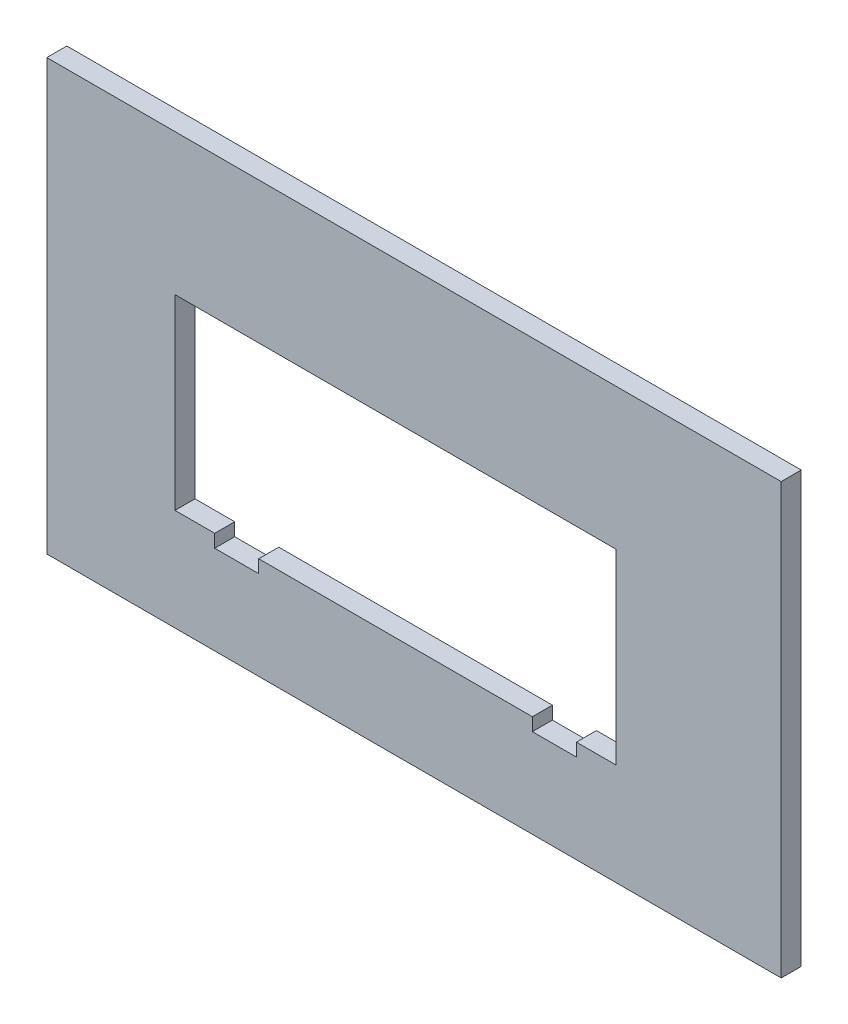
from build123d import *

# Parameters (mm, degrees)
SKETCH3_W               = 55.024039141
SKETCH3_H               = 32.210333873
BOSS_EXTRUDE1_DEPTH     = 1.5
SKETCH4_W               = 14
SKETCH4_H               = 14
CUT_EXTRUDE1_DEPTH      = 1.5
CUT_EXTRUDE4_DEPTH      = 327.051192929
CUT_EXTRUDE4_DEPTH_BACK = 327.051192929


with BuildPart() as part:
    # Sketch3 → Boss-Extrude1 (new body)
    with BuildSketch(Plane.XY):
        with Locations((282.811419242, 83.927296462)):
            Rectangle(SKETCH3_W, SKETCH3_H)
    extrude(amount=BOSS_EXTRUDE1_DEPTH)

    # Sketch4 → Cut-Extrude1 (cut)
    with BuildSketch(Plane.XY.offset(1.5)):
        with Locations((271.905830275, 82.45473243)):
            Rectangle(SKETCH4_W, SKETCH4_H)
        with Locations((290.956988381, 82.45473243)):
            Rectangle(SKETCH4_W, SKETCH4_H)
    extrude(amount=-CUT_EXTRUDE1_DEPTH, mode=Mode.SUBTRACT)

    # Sketch1 → Cut-Extrude4 (cut, two sides: drawn at the far end of the back side and taken through both)
    with BuildSketch(Plane.XY.offset(-CUT_EXTRUDE4_DEPTH_BACK)):
        Polygon((272.906316619, 84.755597823), (272.906316619, 87.985794184), (266.155906266, 87.985794184), (266.155906266, 84.755597823), (265.330856112, 84.755597823), (265.330856112, 81.955427603), (266.155906266, 81.955427603), (266.155906266, 75.684746413), (267.880011074, 75.684746413), (267.880011074, 74.484573455), (271.18021169, 74.484573455), (271.18021169, 75.684746413), (272.906316619, 75.684746413), (272.906316619, 80.155418181), (274.431409328, 80.155418181), (274.431409328, 75.45473243), (288.431409328, 75.45473243), (288.431409328, 80.155418181), (289.956502038, 80.155418181), (289.956502038, 75.684746413), (291.680606845, 75.684746413), (291.680606845, 74.484573455), (294.980807461, 74.484573455), (294.980807461, 75.684746413), (296.70691239, 75.684746413), (296.70691239, 81.955427603), (297.530962483, 81.955427603), (297.530962483, 84.755446764), (296.70691239, 84.755446764), (296.70691239, 87.985643125), (289.956502038, 87.985643125), (289.956502038, 84.755446764), (288.431409328, 84.755446764), (288.431409328, 89.45473243), (274.431409328, 89.45473243), (274.431409328, 84.755597823), align=None)
    extrude(amount=CUT_EXTRUDE4_DEPTH + CUT_EXTRUDE4_DEPTH_BACK, mode=Mode.SUBTRACT)


solid = part.part
